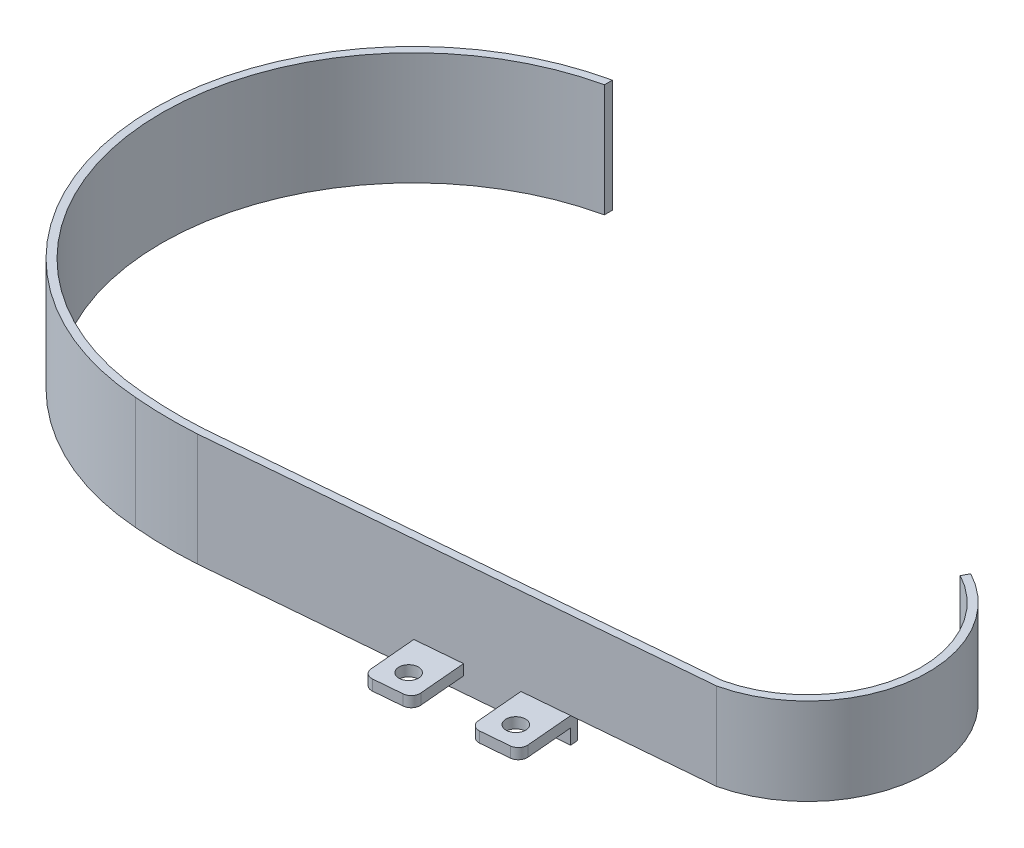
from build123d import *

# Parameters (mm, degrees)
BOSS_EXTRUDE1_DEPTH      = 18.161
BOSS_EXTRUDE1_DEPTH_BACK = 22.3266
SKETCH2_W                = 50.8
SKETCH2_H                = 9.2198
CUT_EXTRUDE1_DEPTH       = 284.270468487
SKETCH3_W                = 16.51
SKETCH3_H                = 3.81
BOSS_EXTRUDE2_DEPTH      = 20.066
FILLET1_R                = 3.175
SKETCH6_R                = 3.5
CUT_EXTRUDE2_DEPTH       = 247.712568685


with BuildPart() as part:
    # Sketch1 → Boss-Extrude1 (new, two sides: drawn at the far end of the back side and taken through both)
    with BuildSketch(Plane(origin=(0, 0, 0), x_dir=(1, 0, 0), z_dir=(0, 1, 0)).offset(-BOSS_EXTRUDE1_DEPTH_BACK)):
        with BuildLine():
            Line((196.889409017, -0.425348601), (198.20116227, 2.041580543))
            ThreePointArc((198.20116227, 2.041580543), (220.828085525, -41.989964588), (187.443785094, -78.544623763))
            Line((187.443785094, -78.544623763), (15.733893811, -93.397170278))
            ThreePointArc((15.733893811, -93.397170278), (4.433186875, -93.703720252), (-6.857314776, -93.134051394))
            ThreePointArc((-6.857314776, -93.134051394), (-93.157259302, -6.53447277), (-19.791883622, 91.264755726))
            Line((-19.791883622, 91.264755726), (-19.791883622, 88.403734249))
            ThreePointArc((-19.791883622, 88.403734249), (-90.355870432, -6.538773964), (-6.857314776, -90.332254043))
            ThreePointArc((-6.857314776, -90.332254043), (4.432766695, -90.912759675), (15.733893811, -90.617036256))
            Line((15.733893811, -90.617036256), (186.839155599, -75.816788928))
            ThreePointArc((186.839155599, -75.816788928), (218.059607792, -41.613105239), (196.889409017, -0.425348601))
        make_face()
    extrude(amount=BOSS_EXTRUDE1_DEPTH + BOSS_EXTRUDE1_DEPTH_BACK)

    # Sketch2 → Cut-Extrude1 (cut, through all)
    with BuildSketch(Plane(origin=(8.135510173, 0, 94.054414573), x_dir=(0.9962799178494617, 0, -0.08617612946674955), z_dir=(0.08617612946674955, 0, 0.9962799178494617))):
        Polygon((131.550880619, -13.1068), (131.550880619, -22.3266), (179.977807149, -22.3266), (179.977807149, -13.1068), (133.582880619, -13.1068), align=None)
        with Locations((205.377807149, -17.7167)):
            Rectangle(SKETCH2_W, SKETCH2_H)
    extrude(amount=-CUT_EXTRUDE1_DEPTH, mode=Mode.SUBTRACT)

    # Sketch3 → Boss-Extrude2 (add)
    with BuildSketch(Plane(origin=(8.135510173, 0, 94.054414573), x_dir=(0.9962799178494617, 0, -0.08617612946674955), z_dir=(0.08617612946674955, 0, 0.9962799178494617))):
        with Locations((123.295880619, -15.0118)):
            Rectangle(SKETCH3_W, SKETCH3_H)
        with Locations((87.735880619, -15.0118)):
            Rectangle(SKETCH3_W, SKETCH3_H)
    extrude(amount=BOSS_EXTRUDE2_DEPTH)

    # Fillet1
    fillet1_edges = [part.edges().sort_by_distance(p)[0] for p in [
        (140.926220923, -15.0118, 102.709221685),
        (124.47763948, -15.0118, 104.131989583),
        (105.498507044, -15.0118, 105.773644849),
        (89.049925601, -15.0118, 107.196412746),
    ]]
    fillet(fillet1_edges, radius=FILLET1_R)

    # Sketch6 → Cut-Extrude2 (cut, through all)
    with BuildSketch(Plane(origin=(0, 0, 0), x_dir=(1, 0, 0), z_dir=(0, 1, 0))):
        with Locations(Location((96.706652463, -98.449712297, 0), (0, 0, 270))):
            Circle(SKETCH6_R)
        with Locations(Location((132.134366342, -95.385289133, 0), (0, 0, 180))):
            Circle(SKETCH6_R)
    extrude(amount=-CUT_EXTRUDE2_DEPTH, mode=Mode.SUBTRACT)


solid = part.part
